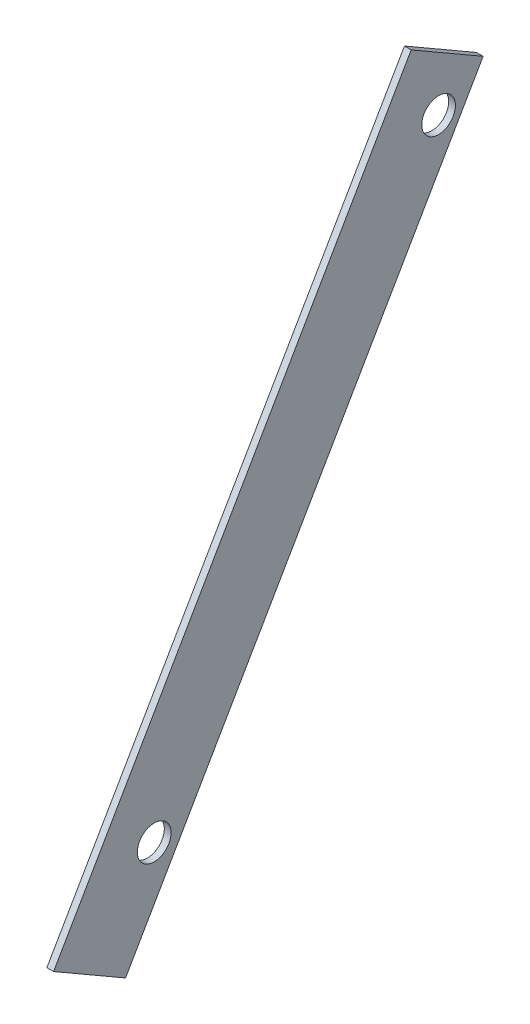
from build123d import *

# Parameters (mm, degrees)
BOSS_EXTRUDE1_DEPTH = 20
SKETCH2_R           = 50
CUT_EXTRUDE4_DEPTH  = 2239.523130199
SKETCH3_R           = 50
CUT_EXTRUDE6_DEPTH  = 2239.523130199


with BuildPart() as part:
    # Sketch1 → Boss-Extrude1 (new body)
    with BuildSketch(Plane(origin=(0, 0, 0), x_dir=(0, 0, -1), z_dir=(1, 0, 0))):
        Polygon((0, 0), (-1061.95, -1839.351355098), (-1275.685069654, -1715.951355098), (-213.735069654, 123.4), align=None)
    extrude(amount=BOSS_EXTRUDE1_DEPTH)

    # Sketch2 → Cut-Extrude4 (cut, through all)
    with BuildSketch(Plane.ZY):
        with Locations((976.888502518, -1533.278698946)):
            Circle(SKETCH2_R)
    extrude(amount=-CUT_EXTRUDE4_DEPTH, mode=Mode.SUBTRACT)

    # Sketch3 → Cut-Extrude6 (cut, through all)
    with BuildSketch(Plane(origin=(20, 0, 0), x_dir=(0, 0, -1), z_dir=(1, 0, 0))):
        with Locations((-132.380349241, -85.096529142)):
            Circle(SKETCH3_R)
    extrude(amount=-CUT_EXTRUDE6_DEPTH, mode=Mode.SUBTRACT)


solid = part.part
